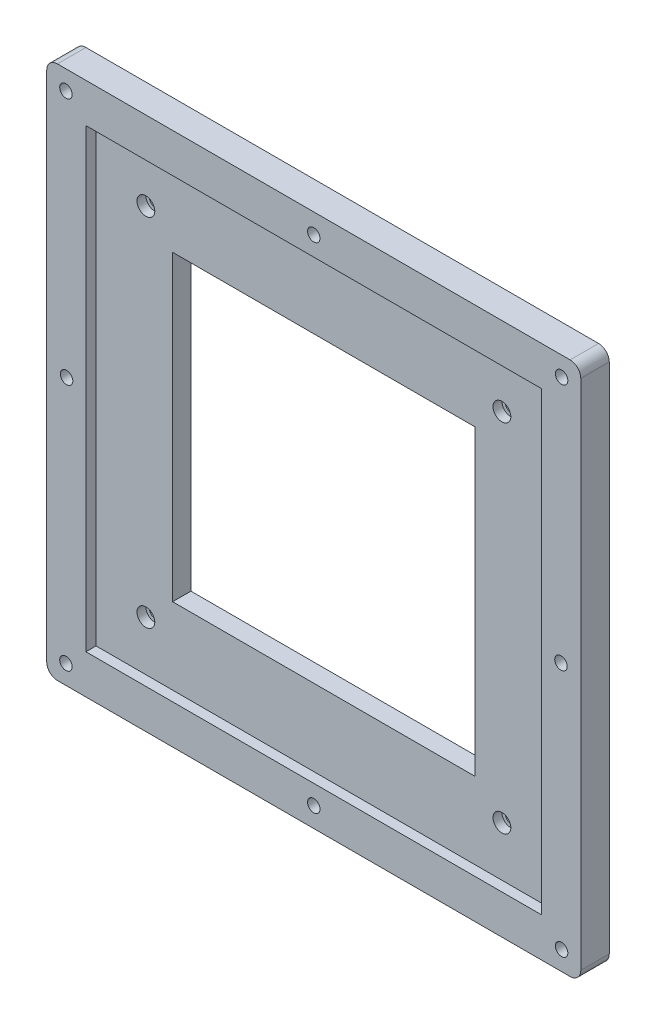
from build123d import *

# Parameters (mm, degrees)
SKETCH1_W           = 150
SKETCH1_H           = 150
SKETCH1_R           = 1.5
SKETCH1_W_2         = 85
SKETCH1_H_2         = 85
BOSS_EXTRUDE1_DEPTH = 8
SKETCH3_W           = 128
SKETCH3_H           = 128
CUT_EXTRUDE2_DEPTH  = 2.85
FILLET1_R           = 3
SKETCH4_R           = 2.5
CUT_EXTRUDE3_DEPTH  = 2.5
SKETCH5_R           = 1.75
CUT_EXTRUDE4_DEPTH  = 23


with BuildPart() as part:
    # Sketch1 → Boss-Extrude1 (new body)
    with BuildSketch(Plane.XY):
        Rectangle(SKETCH1_W, SKETCH1_H)
        with Locations((-50, 50)):
            Circle(SKETCH1_R, mode=Mode.SUBTRACT)
        with Locations((50, 50)):
            Circle(SKETCH1_R, mode=Mode.SUBTRACT)
        with Locations((50, -50)):
            Circle(SKETCH1_R, mode=Mode.SUBTRACT)
        with Locations((-50, -50)):
            Circle(SKETCH1_R, mode=Mode.SUBTRACT)
        Rectangle(SKETCH1_W_2, SKETCH1_H_2, mode=Mode.SUBTRACT)
    extrude(amount=BOSS_EXTRUDE1_DEPTH)

    # Sketch3 → Cut-Extrude2 (cut)
    with BuildSketch(Plane.XY.offset(8)):
        Rectangle(SKETCH3_W, SKETCH3_H)
    extrude(amount=-CUT_EXTRUDE2_DEPTH, mode=Mode.SUBTRACT)

    # Fillet1
    fillet1_edges = [part.edges().sort_by_distance(p)[0] for p in [
        (75, -75, 4),
        (-75, -75, 4),
        (-75, 75, 4),
        (75, 75, 4),
    ]]
    fillet(fillet1_edges, radius=FILLET1_R)

    # Sketch4 → Cut-Extrude3 (cut)
    with BuildSketch(Plane(origin=(0, 0, 5.15), x_dir=(-1, 0, 0), z_dir=(0, 0, -1))):
        with Locations((-50, 50)):
            Circle(SKETCH4_R)
        with Locations((50, 50)):
            Circle(SKETCH4_R)
        with Locations((50, -50)):
            Circle(SKETCH4_R)
        with Locations((-50, -50)):
            Circle(SKETCH4_R)
    extrude(amount=CUT_EXTRUDE3_DEPTH, mode=Mode.SUBTRACT)

    # Sketch5 → Cut-Extrude4 (cut)
    with BuildSketch(Plane.XY.offset(8)):
        with Locations((0, 69.431322576)):
            Circle(SKETCH5_R)
        with Locations((-69.610191061, 69.610191061)):
            Circle(SKETCH5_R)
        with Locations((69.431322576, 0)):
            Circle(SKETCH5_R)
        with Locations((69.610191061, 69.610191061)):
            Circle(SKETCH5_R)
        with Locations((0, -69.431322576)):
            Circle(SKETCH5_R)
        with Locations((69.610191061, -69.610191061)):
            Circle(SKETCH5_R)
        with Locations((-69.431322576, 0)):
            Circle(SKETCH5_R)
        with Locations((-69.610191061, -69.610191061)):
            Circle(SKETCH5_R)
    extrude(amount=-CUT_EXTRUDE4_DEPTH, mode=Mode.SUBTRACT)


solid = part.part
